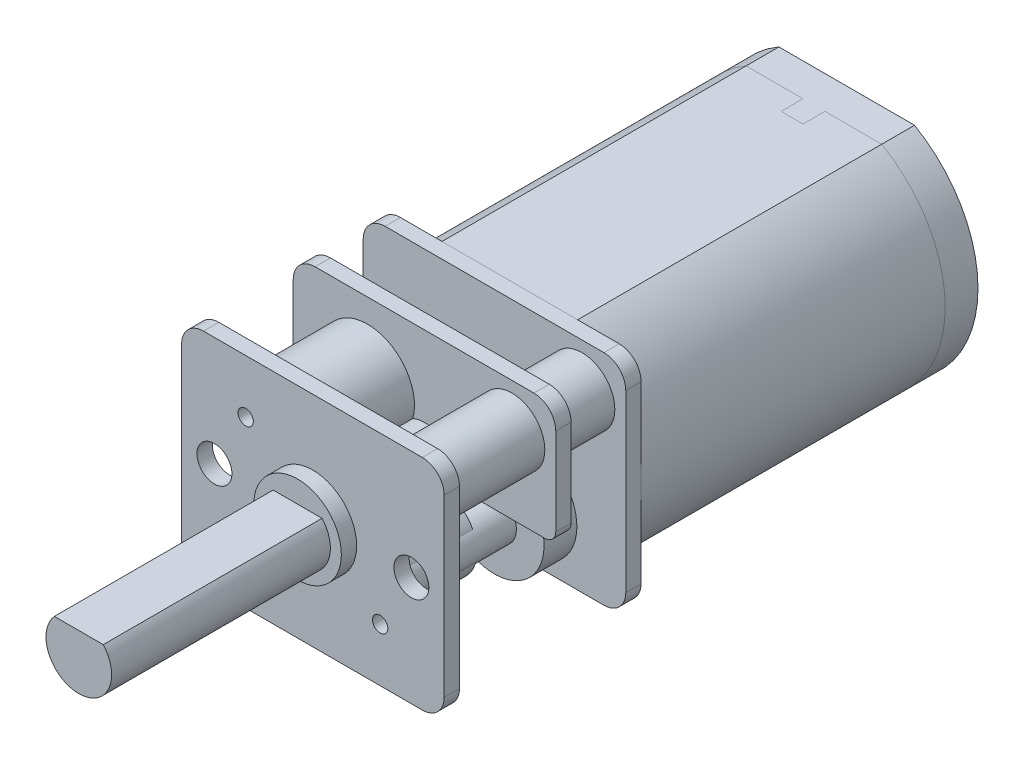
from build123d import *

# Parameters (mm, degrees)
P_IDAT_VYSUNUT_M1_DEPTH   = 15.4
SKICA2_R                  = 2.5
P_IDAT_VYSUNUT_M2_DEPTH   = 0.8
ROZD_LIT1_SURFACE_1_BACK  = 23.504
ROZD_LIT1_SURFACE_1_DEPTH = 47.008
ROZD_LIT1_SURFACE_2_BACK  = 23.504
ROZD_LIT1_SURFACE_2_DEPTH = 47.008
P_IDAT_VYSUNUT_M4_DEPTH   = 0.7
SKICA8_R                  = 1.5
P_IDAT_VYSUNUT_M6_DEPTH   = 2.5
P_IDAT_VYSUNUT_M7_DEPTH   = 0.7
SKICA10_R                 = 1.5
P_IDAT_VYSUNUT_M8_DEPTH   = 4.4
P_IDAT_VYSUNUT_M9_DEPTH   = 0.7
SKICA12_R                 = 2
P_IDAT_VYSUNUT_M10_DEPTH  = 0.7
P_IDAT_VYSUNUT_M11_DEPTH  = 10
SKICA14_R                 = 0.8
ODEBRAT_VYSUNUT_M1_DEPTH  = 0.7
SKICA15_R                 = 0.35
ODEBRAT_VYSUNUT_M2_DEPTH  = 0.7
SKICA16_R                 = 0.4
P_IDAT_VYSUNUT_M12_DEPTH  = 0.5
SKICA17_R                 = 0.75
SKICA17_R_2               = 2.265475947
P_IDAT_VYSUNUT_M13_DEPTH  = 1.5
P_IDAT_VYSUNUT_M15_REACH  = 22.913
SKICA18_R                 = 1
P_IDAT_VYSUNUT_M16_DEPTH  = 4.4
SKICA20_R                 = 3.6
ODEBRAT_VYSUNUT_M3_DEPTH  = 22.191743675


with BuildPart() as part:
    # Skica1 → Přidat vysunutím1 (new body)
    with BuildSketch(Plane.XY):
        with BuildLine():
            Line((-3.1, 5), (3.1, 5))
            ThreePointArc((3.1, 5), (6, 0), (3.1, -5))
            Line((3.1, -5), (-3.1, -5))
            ThreePointArc((-3.1, -5), (-6, 0), (-3.1, 5))
        make_face()
    extrude(amount=-P_IDAT_VYSUNUT_M1_DEPTH)

    # Skica2 → Přidat vysunutím2 (add)
    with BuildSketch(Plane(origin=(0, 0, -15.4), x_dir=(-1, 0, 0), z_dir=(0, 0, -1))):
        Circle(SKICA2_R)
    extrude(amount=P_IDAT_VYSUNUT_M2_DEPTH)


with BuildPart() as body_2:
    # Rozdělit1: the piece behind the surface
    add(part.part)
    # Rozdělit1 surface: a surface, the sketch's curves swept straight by 47.008 mm
    with BuildLine(Plane(origin=(0, 0, 0), x_dir=(1, 0, 0), z_dir=(0, 1, 0)).offset(-ROZD_LIT1_SURFACE_1_BACK), mode=Mode.PRIVATE) as rozd_lit1_surface_1_path:
        Line((-6, 13.9), (-0.5, 13.9))
        Line((-0.5, 13.9), (-0.5, 12.9))
        Line((-0.5, 12.9), (0.5, 12.9))
        Line((0.5, 12.9), (0.5, 13.9))
        Line((0.5, 13.9), (6, 13.9))
    rozd_lit1_surface_1 = Shell.extrude(rozd_lit1_surface_1_path.wire(), (0 * ROZD_LIT1_SURFACE_1_DEPTH, 1 * ROZD_LIT1_SURFACE_1_DEPTH, 0 * ROZD_LIT1_SURFACE_1_DEPTH))
    split(bisect_by=rozd_lit1_surface_1, keep=Keep.BOTTOM)

    # Skica20 → Odebrat vysunutím3 (cut, through all)
    with BuildSketch(Plane.XY):
        Circle(SKICA20_R)
    extrude(amount=-ODEBRAT_VYSUNUT_M3_DEPTH, mode=Mode.SUBTRACT)


with BuildPart() as part_1:
    add(part.part)

    # Rozdělit1: split by a surface, the side it looks to stays
    # Rozdělit1 surface: a surface, the sketch's curves swept straight by 47.008 mm
    with BuildLine(Plane(origin=(0, 0, 0), x_dir=(1, 0, 0), z_dir=(0, 1, 0)).offset(-ROZD_LIT1_SURFACE_2_BACK), mode=Mode.PRIVATE) as rozd_lit1_surface_2_path:
        Line((-6, 13.9), (-0.5, 13.9))
        Line((-0.5, 13.9), (-0.5, 12.9))
        Line((-0.5, 12.9), (0.5, 12.9))
        Line((0.5, 12.9), (0.5, 13.9))
        Line((0.5, 13.9), (6, 13.9))
    rozd_lit1_surface_2 = Shell.extrude(rozd_lit1_surface_2_path.wire(), (0 * ROZD_LIT1_SURFACE_2_DEPTH, 1 * ROZD_LIT1_SURFACE_2_DEPTH, 0 * ROZD_LIT1_SURFACE_2_DEPTH))
    split(bisect_by=rozd_lit1_surface_2, keep=Keep.TOP)


with BuildPart() as body_3:
    # Skica6 → Přidat vysunutím4 (new body)
    with BuildSketch(Plane.XY):
        with BuildLine():
            Line((-5, 5), (5, 5))
            ThreePointArc((5, 5), (5.707106781, 4.707106781), (6, 4))
            Line((6, 4), (6, -4))
            ThreePointArc((6, -4), (5.707106781, -4.707106781), (5, -5))
            Line((5, -5), (-5, -5))
            ThreePointArc((-5, -5), (-5.707106781, -4.707106781), (-6, -4))
            Line((-6, -4), (-6, 4))
            ThreePointArc((-6, 4), (-5.707106781, 4.707106781), (-5, 5))
        make_face()
    extrude(amount=P_IDAT_VYSUNUT_M4_DEPTH)

    # Skica8 → Přidat vysunutím6 (add)
    with BuildSketch(Plane.XY.offset(0.7)):
        with Locations((4, 3)):
            Circle(SKICA8_R)
        with Locations((-4, -3)):
            Circle(SKICA8_R)
    extrude(amount=P_IDAT_VYSUNUT_M6_DEPTH)

    # Skica9 → Přidat vysunutím7 (add)
    with BuildSketch(Plane.XY.offset(3.2)):
        with BuildLine():
            Line((5.5, -0.5), (1.5, -0.5))
            ThreePointArc((1.5, -0.5), (0.085786438, -1.085786438), (-0.5, -2.5))
            Line((-0.5, -2.5), (-0.5, -4.5))
            ThreePointArc((-0.5, -4.5), (-0.646446609, -4.853553391), (-1, -5))
            Line((-1, -5), (-5, -5))
            ThreePointArc((-5, -5), (-5.707106781, -4.707106781), (-6, -4))
            Line((-6, -4), (-6, 4))
            ThreePointArc((-6, 4), (-5.707106781, 4.707106781), (-5, 5))
            Line((-5, 5), (5, 5))
            ThreePointArc((5, 5), (5.707106781, 4.707106781), (6, 4))
            Line((6, 4), (6, 0))
            ThreePointArc((6, 0), (5.853553391, -0.353553391), (5.5, -0.5))
        make_face()
    extrude(amount=P_IDAT_VYSUNUT_M7_DEPTH)

    # Skica10 → Přidat vysunutím8 (add)
    with BuildSketch(Plane.XY.offset(3.9)):
        with Locations((-4, -3)):
            Circle(SKICA10_R)
        with Locations((4, 3)):
            Circle(SKICA10_R)
    extrude(amount=P_IDAT_VYSUNUT_M8_DEPTH)

    # Skica11 → Přidat vysunutím9 (add)
    with BuildSketch(Plane.XY.offset(8.3)):
        with BuildLine():
            Line((6, -4), (6, 4))
            ThreePointArc((6, 4), (5.707106781, 4.707106781), (5, 5))
            Line((5, 5), (-5, 5))
            ThreePointArc((-5, 5), (-5.707106781, 4.707106781), (-6, 4))
            Line((-6, 4), (-6, -4))
            ThreePointArc((-6, -4), (-5.707106781, -4.707106781), (-5, -5))
            Line((-5, -5), (5, -5))
            ThreePointArc((5, -5), (5.707106781, -4.707106781), (6, -4))
        make_face()
    extrude(amount=P_IDAT_VYSUNUT_M9_DEPTH)

    # Skica12 → Přidat vysunutím10 (add)
    with BuildSketch(Plane.XY.offset(9)):
        Circle(SKICA12_R)
    extrude(amount=P_IDAT_VYSUNUT_M10_DEPTH)

    # Skica14 → Odebrat vysunutím1 (cut)
    with BuildSketch(Plane.XY.offset(9)):
        with Locations((-4.5, 0)):
            Circle(SKICA14_R)
        with Locations((4.5, 0)):
            Circle(SKICA14_R)
    extrude(amount=-ODEBRAT_VYSUNUT_M1_DEPTH, mode=Mode.SUBTRACT)

    # Skica15 → Odebrat vysunutím2 (cut)
    with BuildSketch(Plane.XY.offset(9)):
        with Locations((-3.072885118, 2.560737599)):
            Circle(SKICA15_R)
        with Locations((3.072885118, -2.560737599)):
            Circle(SKICA15_R)
    extrude(amount=-ODEBRAT_VYSUNUT_M2_DEPTH, mode=Mode.SUBTRACT)


with BuildPart() as body_4:
    # Skica13 → Přidat vysunutím11 (new body)
    with BuildSketch(Plane.XY.offset(9.7)):
        with BuildLine():
            Line((-1.118033989, 1), (1.118033989, 1))
            ThreePointArc((1.118033989, 1), (0, -1.5), (-1.118033989, 1))
        make_face()
    extrude(amount=P_IDAT_VYSUNUT_M11_DEPTH)


with BuildPart() as body_5:
    # Skica16 → Přidat vysunutím12 (new body)
    with BuildSketch(Plane(origin=(3.1, 0, 0), x_dir=(0, 0, -1), z_dir=(1, 0, 0))):
        with BuildLine():
            Line((15.4, 1), (16.2, 1))
            ThreePointArc((16.2, 1), (17.2, 0), (16.2, -1))
            Line((16.2, -1), (15.4, -1))
            Line((15.4, -1), (15.4, 1))
        make_face()
        with Locations((16.2, 0)):
            Circle(SKICA16_R, mode=Mode.SUBTRACT)
    extrude(amount=P_IDAT_VYSUNUT_M12_DEPTH)


with BuildPart() as body_6:
    # Zrcadlit2: mirrored copy
    add(body_5.part.mirror(Plane(origin=(0, 0, 0), x_dir=(0, 0, 1), z_dir=(1, 0, 0))))


with BuildPart() as body_7:
    # Skica17 → Přidat vysunutím13 (new body)
    with BuildSketch(Plane.XY.offset(0.7)):
        Circle(SKICA17_R)
        with Locations((1.5, -2.5)):
            Circle(SKICA17_R_2)
    extrude(amount=P_IDAT_VYSUNUT_M13_DEPTH)


    # Skica18 → Přidat vysunutím15 (add, up to next)
    with BuildSketch(Plane.XY.offset(2.2), mode=Mode.PRIVATE) as p_idat_vysunut_m15_sk1:
        with Locations((1.5, -2.5)):
            Circle(SKICA18_R)
    p_idat_vysunut_m15_tool1 = extrude(p_idat_vysunut_m15_sk1.sketch, amount=P_IDAT_VYSUNUT_M15_REACH, mode=Mode.PRIVATE) - body_3.part
    add(p_idat_vysunut_m15_tool1.solids().sort_by_distance((1.5, -2.5, 2.2))[0])

    # Skica19 → Přidat vysunutím16 (add)
    with BuildSketch(Plane.XY.offset(3.9)):
        with BuildLine():
            ThreePointArc((-0.530429014, 1.226311832), (-4.375545565, 2.989203675), (-1.335240944, 0.0482418))
            ThreePointArc((-1.335240944, 0.0482418), (-1.087139563, -0.776738835), (-0.387088986, -1.278811075))
            ThreePointArc((-0.387088986, -1.278811075), (1.14651795, -4.227627949), (0.980150108, -0.908020603))
            ThreePointArc((0.980150108, -0.908020603), (1.090598918, 0.771874114), (-0.530429014, 1.226311832))
        make_face()
    extrude(amount=P_IDAT_VYSUNUT_M16_DEPTH)

    # Skica21 → Rotovat1 (revolve)
    with BuildSketch(Plane(origin=(0, 0, 0), x_dir=(0, 0, -1), z_dir=(1, 0, 0))):
        Polygon((-2.95, 0), (-2.2, 0.75), (-2.2, 0), align=None)
    revolve(axis=Axis((0, 0, 0), (0, 0, 1)))


solid = Compound([body_2.part, part_1.part, body_3.part, body_4.part, body_5.part, body_6.part, body_7.part])
